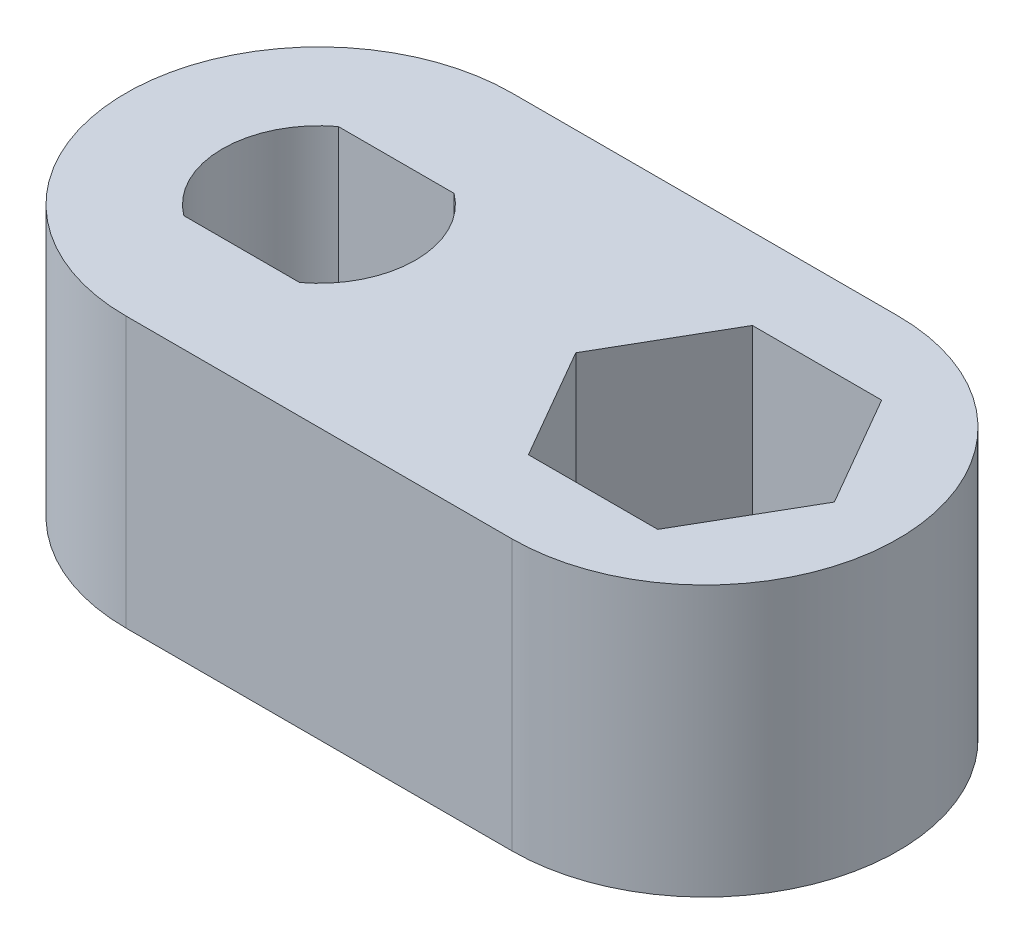
from build123d import *

# Parameters (mm, degrees)
EXTRUDE_2_DEPTH              = 7
CUT_EXTRUDE_1_DEPTH          = 4
HOLE_WIZARD_M3_1_D           = 3.4
HOLE_WIZARD_M3_1_CSINK_D     = 6.72
HOLE_WIZARD_M3_1_CSINK_ANGLE = 90
HOLE_WIZARD_1_D              = 4.15
HOLE_WIZARD_1_DEPTH          = 10
CUT_EXTRUDE_2_DEPTH          = 5


with BuildPart() as part:
    # 草图1 → 凸台-拉伸2 (new body)
    with BuildSketch(Plane(origin=(0, 0, 0), x_dir=(1, 0, 0), z_dir=(0, 1, 0))):
        with BuildLine():
            Line((0, 5), (10, 5))
            ThreePointArc((10, 5), (15, 0), (10, -5))
            Line((10, -5), (0, -5))
            ThreePointArc((0, -5), (-5, 0), (0, 5))
        make_face()
    extrude(amount=EXTRUDE_2_DEPTH)

    # 草图2 → 切除-拉伸1 (cut)
    with BuildSketch(Plane(origin=(0, 7, 0), x_dir=(1, 0, 0), z_dir=(0, 1, 0))):
        with BuildLine():
            Line((1.5, 2), (-1.5, 2))
            ThreePointArc((-1.5, 2), (-2.5, 0), (-1.5, -2))
            Line((-1.5, -2), (1.5, -2))
            ThreePointArc((1.5, -2), (2.236067977, -1.118033989), (2.5, 0))
            ThreePointArc((2.5, 0), (2.236067977, 1.118033989), (1.5, 2))
        make_face()
    extrude(amount=-CUT_EXTRUDE_1_DEPTH, mode=Mode.SUBTRACT)

    # M3 六角凹锥坑螺钉的锥形沉头孔1 (through all)
    with Locations(Plane(origin=(0, 0, 0), x_dir=(-1, 0, 0), z_dir=(0, -1, 0))):
        with Locations((0, 0)):
            CounterSinkHole(HOLE_WIZARD_M3_1_D / 2, HOLE_WIZARD_M3_1_CSINK_D / 2, counter_sink_angle=HOLE_WIZARD_M3_1_CSINK_ANGLE)

    # 孔1
    with Locations(Plane(origin=(0, 7, 0), x_dir=(1, 0, 0), z_dir=(0, 1, 0))):
        with Locations((10, 0)):
            Hole(HOLE_WIZARD_1_D / 2, depth=HOLE_WIZARD_1_DEPTH)

    # 草图8 → 切除-拉伸2 (cut)
    with BuildSketch(Plane(origin=(0, 7, 0), x_dir=(1, 0, 0), z_dir=(0, 1, 0))):
        Polygon((13.348631561, 0), (11.674315781, 2.9), (8.325684219, 2.9), (6.651368439, 0), (8.325684219, -2.9), (11.674315781, -2.9), align=None)
    extrude(amount=-CUT_EXTRUDE_2_DEPTH, mode=Mode.SUBTRACT)


solid = part.part
